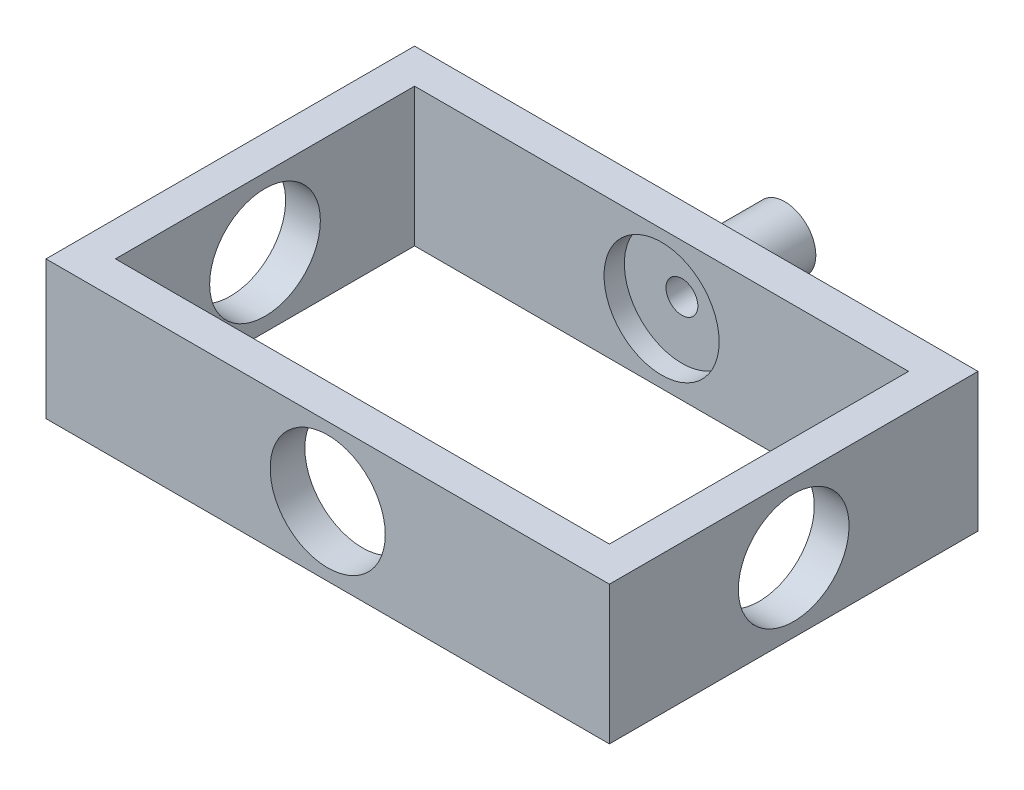
from build123d import *

# Parameters (mm, degrees)
SKETCH1_W           = 32.3215
SKETCH1_H           = 21.1455
SKETCH1_W_2         = 28.33878
SKETCH1_H_2         = 17.16278
BOSS_EXTRUDE1_DEPTH = 7.9375
SKETCH2_R           = 3.175
CUT_EXTRUDE1_DEPTH  = 37.1475
SKETCH3_R           = 3.302
CUT_EXTRUDE2_DEPTH  = 20.32
SKETCH4_R           = 1.778
BOSS_EXTRUDE3_DEPTH = 5.08
SKETCH6_R           = 0.9144
CUT_EXTRUDE3_DEPTH  = 10.922


with BuildPart() as part:
    # Sketch1 → Boss-Extrude1 (new body)
    with BuildSketch(Plane(origin=(0, 0, 0), x_dir=(1, 0, 0), z_dir=(0, 1, 0))):
        Rectangle(SKETCH1_W, SKETCH1_H)
        Rectangle(SKETCH1_W_2, SKETCH1_H_2, mode=Mode.SUBTRACT)
    extrude(amount=BOSS_EXTRUDE1_DEPTH)

    # Sketch2 → Cut-Extrude1 (cut)
    with BuildSketch(Plane.ZY.offset(16.16075)):
        with Locations((0, 3.96875)):
            Circle(SKETCH2_R)
    extrude(amount=-CUT_EXTRUDE1_DEPTH, mode=Mode.SUBTRACT)

    # Sketch3 → Cut-Extrude2 (cut)
    with BuildSketch(Plane.XY.offset(10.57275)):
        with Locations((0, 3.96875)):
            Circle(SKETCH3_R)
    extrude(amount=-CUT_EXTRUDE2_DEPTH, mode=Mode.SUBTRACT)

    # Sketch4 → Boss-Extrude3 (add)
    with BuildSketch(Plane(origin=(0, 0, -10.57275), x_dir=(-1, 0, 0), z_dir=(0, 0, -1))):
        with Locations(Location((0, 3.96875, 0), (0, 0, 180))):
            Circle(SKETCH4_R)
    extrude(amount=BOSS_EXTRUDE3_DEPTH)

    # Sketch6 → Cut-Extrude3 (cut)
    with BuildSketch(Plane(origin=(0, 0, -15.65275), x_dir=(-1, 0, 0), z_dir=(0, 0, -1))):
        with Locations((0, 3.96875)):
            Circle(SKETCH6_R)
    extrude(amount=-CUT_EXTRUDE3_DEPTH, mode=Mode.SUBTRACT)


solid = part.part
